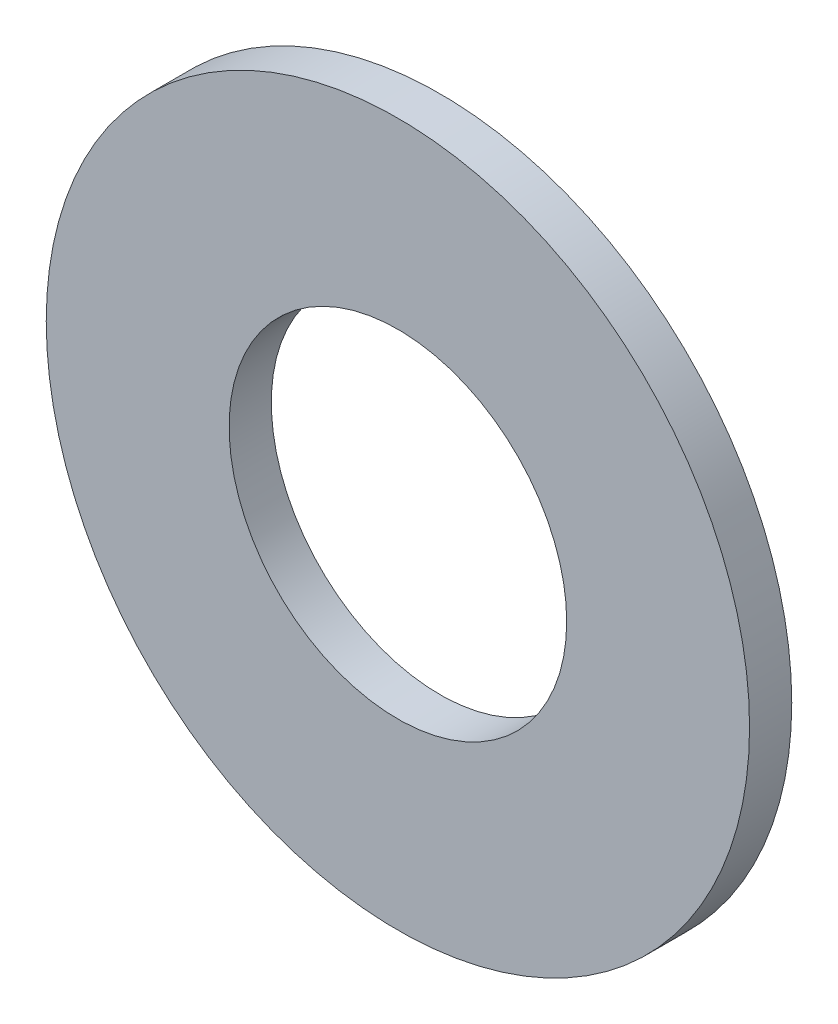
from build123d import *

# Parameters (mm, degrees)
SKETCH_1_R        = 2.5
SKETCH_1_R_2      = 1.2
EXTRUDE_148_DEPTH = 0.3


with BuildPart() as part:
    # Эскиз1 → Extrude 148 (new body)
    with BuildSketch(Plane.XY):
        Circle(SKETCH_1_R)
        Circle(SKETCH_1_R_2, mode=Mode.SUBTRACT)
    extrude(amount=EXTRUDE_148_DEPTH)


solid = part.part
